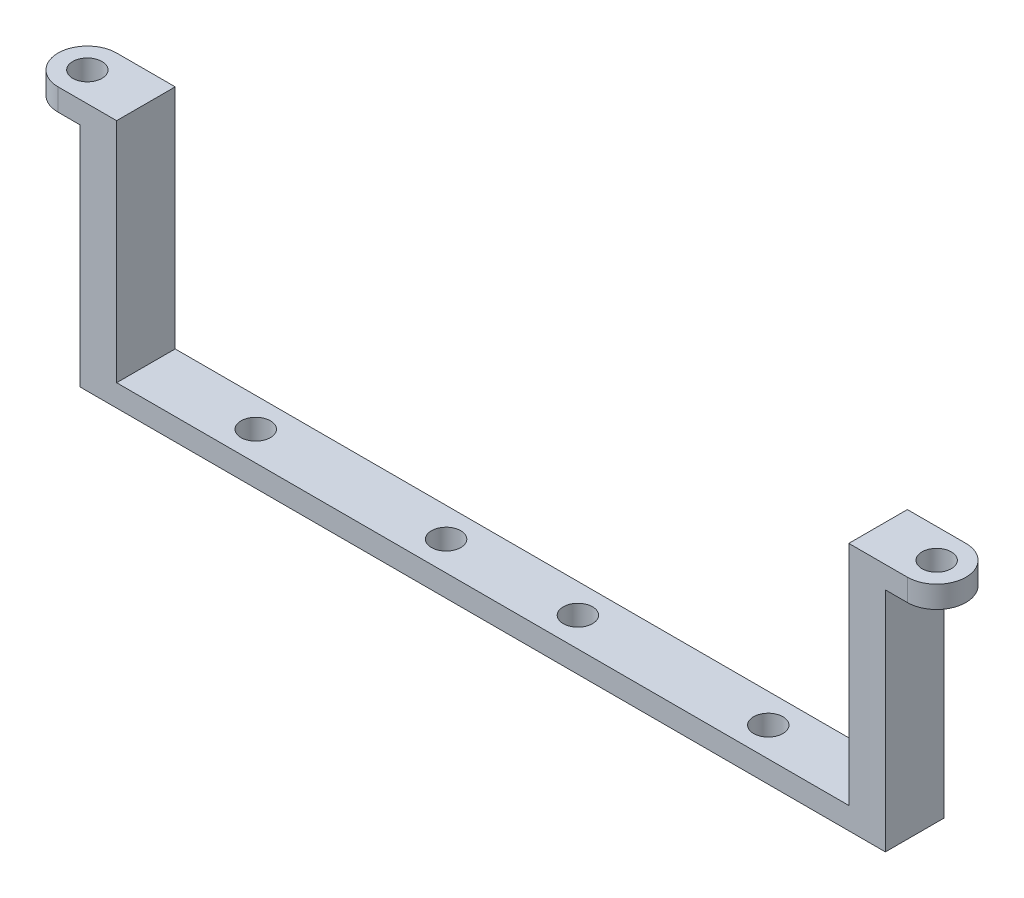
from build123d import *

# Parameters (mm, degrees)
SKETCH1_W           = 110
SKETCH1_H           = 8
SKETCH1_R           = 2
BOSS_EXTRUDE1_DEPTH = 3
SKETCH2_W           = 5
SKETCH2_H           = 8
BOSS_EXTRUDE2_DEPTH = 28
SKETCH3_R           = 2
BOSS_EXTRUDE3_DEPTH = 3


with BuildPart() as part:
    # Sketch1 → Boss-Extrude1 (new body)
    with BuildSketch(Plane(origin=(0, 0, 0), x_dir=(1, 0, 0), z_dir=(0, 1, 0))):
        Rectangle(SKETCH1_W, SKETCH1_H)
        with Locations(Location((-35, 0, 0), (0, 0, 270))):
            Circle(SKETCH1_R, mode=Mode.SUBTRACT)
        with Locations(Location((35, 0, 0), (0, 0, 270))):
            Circle(SKETCH1_R, mode=Mode.SUBTRACT)
        with Locations(Location((-9, 0, 0), (0, 0, 270))):
            Circle(SKETCH1_R, mode=Mode.SUBTRACT)
        with Locations(Location((9, 0, 0), (0, 0, 270))):
            Circle(SKETCH1_R, mode=Mode.SUBTRACT)
    extrude(amount=BOSS_EXTRUDE1_DEPTH)

    # Sketch2 → Boss-Extrude2 (add)
    with BuildSketch(Plane(origin=(0, 3, 0), x_dir=(1, 0, 0), z_dir=(0, 1, 0))):
        with Locations((-52.5, 0)):
            Rectangle(SKETCH2_W, SKETCH2_H)
        with Locations((52.5, 0)):
            Rectangle(SKETCH2_W, SKETCH2_H)
    extrude(amount=BOSS_EXTRUDE2_DEPTH)

    # Sketch3 → Boss-Extrude3 (add)
    # profile 1 of 2: a face of its own
    with BuildSketch(Plane(origin=(0, 31, 0), x_dir=(1, 0, 0), z_dir=(0, 1, 0))):
        with BuildLine():
            Line((-50, 4), (-58, 4))
            ThreePointArc((-58, 4), (-62, 0), (-58, -4))
            Line((-58, -4), (-50, -4))
            Line((-50, -4), (-50, 4))
        make_face()
        with Locations(Location((-58, 0, 0), (0, 0, 270))):
            Circle(SKETCH3_R, mode=Mode.SUBTRACT)
    # profile 2 of 2: a face of its own
    with BuildSketch(Plane(origin=(0, 31, 0), x_dir=(1, 0, 0), z_dir=(0, 1, 0))):
        with BuildLine():
            Line((50, 4), (58, 4))
            ThreePointArc((58, 4), (62, 0), (58, -4))
            Line((58, -4), (50, -4))
            Line((50, -4), (50, 4))
        make_face()
        with Locations(Location((58, 0, 0), (0, 0, 90))):
            Circle(SKETCH3_R, mode=Mode.SUBTRACT)
    extrude(amount=BOSS_EXTRUDE3_DEPTH)


solid = part.part
